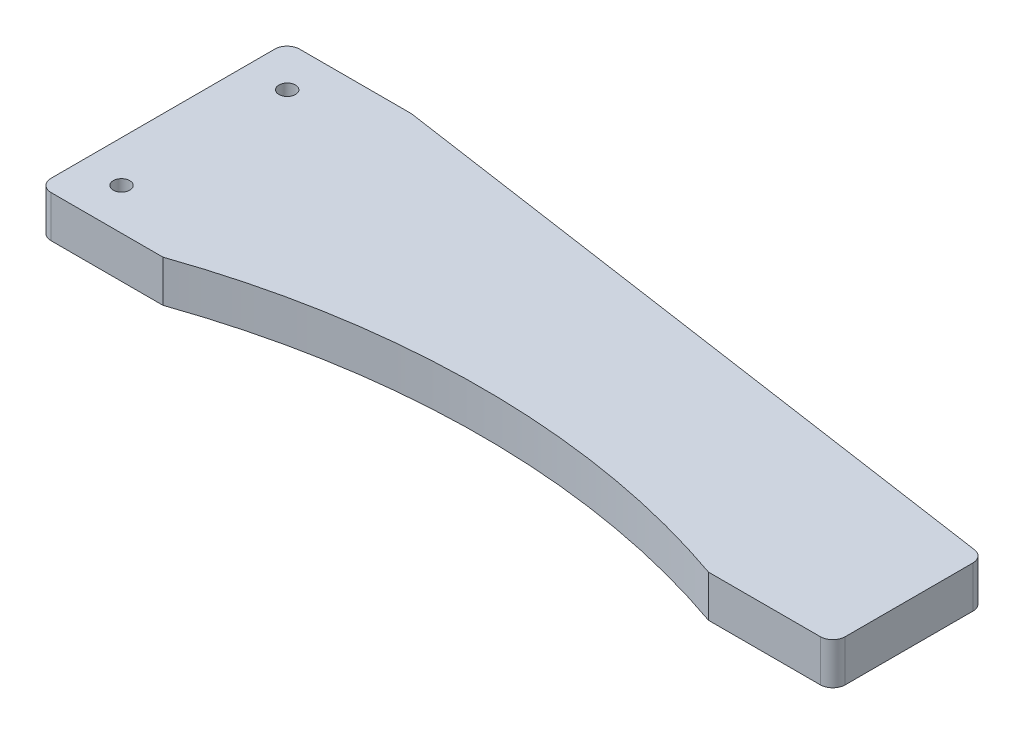
from build123d import *

# Parameters (mm, degrees)
SKETCH1_R           = 1.27
BOSS_EXTRUDE1_DEPTH = 6.4008


with BuildPart() as part:
    # Sketch1 → Boss-Extrude1 (new body)
    with BuildSketch(Plane(origin=(0, 0, 0), x_dir=(1, 0, 0), z_dir=(0, 1, 0))):
        with BuildLine():
            ThreePointArc((1.905, 0), (0.557961582, -0.557961582), (0, -1.905))
            Line((0, -1.905), (0, -36.195))
            ThreePointArc((0, -36.195), (0.557961582, -37.542038418), (1.905, -38.1))
            Line((1.905, -38.1), (19.05, -38.1))
            ThreePointArc((19.05, -38.1), (60.877473761, -31.014396295), (102.704947522, -38.1))
            Line((102.704947522, -38.1), (119.849947522, -38.1))
            ThreePointArc((119.849947522, -38.1), (121.19698594, -37.542038418), (121.754947522, -36.195))
            Line((121.754947522, -36.195), (121.754947522, -16.620142149))
            ThreePointArc((121.754947522, -16.620142149), (121.290875062, -15.374047118), (120.124760829, -14.735068504))
            Line((120.124760829, -14.735068504), (19.186684237, -0.019926355))
            ThreePointArc((19.186684237, -0.019926355), (19.049638318, -0.004988119), (18.911870929, 0))
            Line((18.911870929, 0), (1.905, 0))
        make_face()
        with Locations((6.35, -31.75)):
            Circle(SKETCH1_R, mode=Mode.SUBTRACT)
        with Locations((6.35, -6.35)):
            Circle(SKETCH1_R, mode=Mode.SUBTRACT)
    extrude(amount=BOSS_EXTRUDE1_DEPTH)


solid = part.part
